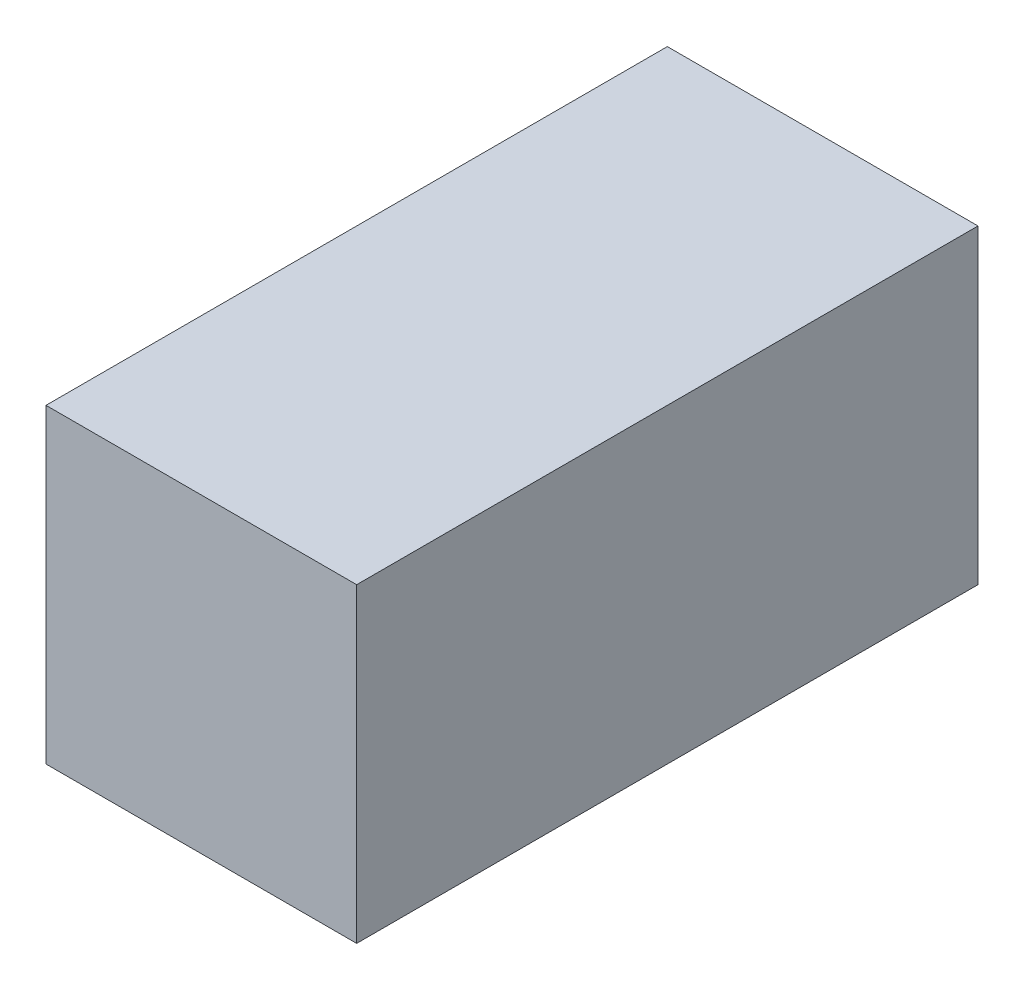
from build123d import *

# Parameters (mm, degrees)
SKETCH1_W           = 50
SKETCH1_H           = 100
BOSS_EXTRUDE1_DEPTH = 50


with BuildPart() as part:
    # Sketch1 → Boss-Extrude1 (new body)
    with BuildSketch(Plane(origin=(0, 0, 0), x_dir=(1, 0, 0), z_dir=(0, 1, 0))):
        Rectangle(SKETCH1_W, SKETCH1_H)
    extrude(amount=BOSS_EXTRUDE1_DEPTH)


solid = part.part
